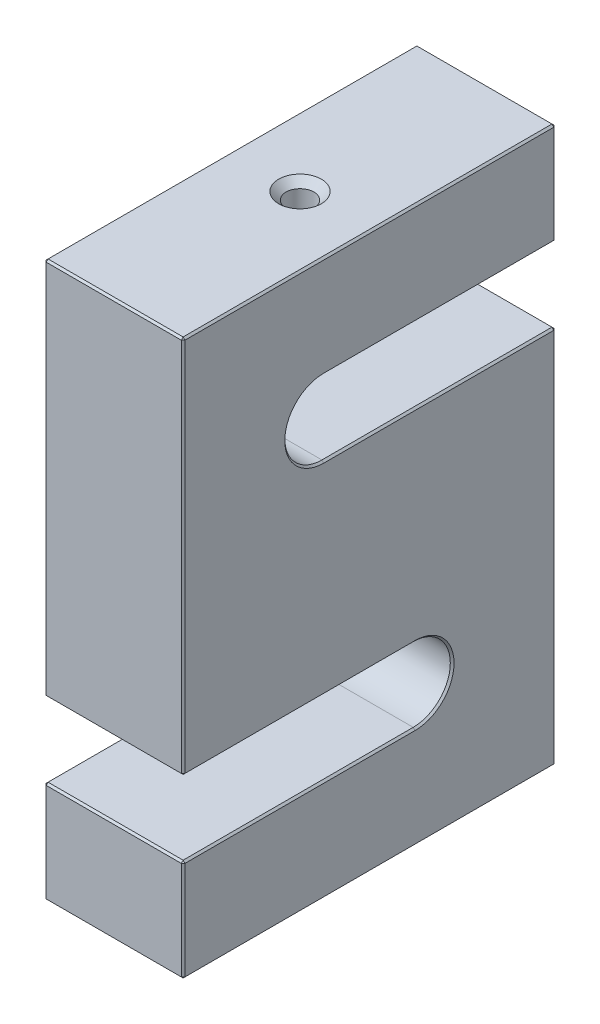
from build123d import *

# Parameters (mm, degrees)
BOSS_EXTRUDE1_DEPTH = 19
SKETCH2_R           = 1.905
CUT_EXTRUDE1_DEPTH  = 10.16
CHAMFER1_SIZE       = 1.016
CHAMFER2_SIZE       = 0.254
CHAMFER3_SIZE       = 1.016


with BuildPart() as part:
    # Sketch1 → Boss-Extrude1 (new body)
    with BuildSketch(Plane(origin=(0, 0, 0), x_dir=(0, 0, -1), z_dir=(1, 0, 0))):
        with BuildLine():
            Line((6.25, -13.87), (-25.5, -13.87))
            Line((-25.5, -13.87), (-25.5, 38))
            Line((-25.5, 38), (25.5, 38))
            Line((25.5, 38), (25.5, 24.08))
            Line((25.5, 24.08), (-6.25, 24.08))
            ThreePointArc((-6.25, 24.08), (-11.33, 19), (-6.25, 13.92))
            Line((-6.25, 13.92), (25.5, 13.92))
            Line((25.5, 13.92), (25.5, -38))
            Line((25.5, -38), (-25.5, -38))
            Line((-25.5, -38), (-25.5, -24.03))
            Line((-25.5, -24.03), (6.25, -24.03))
            ThreePointArc((6.25, -24.03), (11.33, -18.95), (6.25, -13.87))
        make_face()
    extrude(amount=BOSS_EXTRUDE1_DEPTH)

    # Sketch2 → Cut-Extrude1 (cut)
    with BuildSketch(Plane.XZ.offset(38)):
        with Locations(Location((9.5, 0, 0), (0, 0, 270))):
            Circle(SKETCH2_R)
    cut_extrude1 = extrude(amount=-CUT_EXTRUDE1_DEPTH, mode=Mode.SUBTRACT)

    # Chamfer1
    chamfer1_edges = [part.edges().sort_by_distance(p)[0] for p in [
        (9.5, -38, 1.905),
    ]]
    chamfer(chamfer1_edges, length=CHAMFER1_SIZE)

    # Chamfer2
    chamfer2_edges = [part.edges().sort_by_distance(p)[0] for p in [
        (19, -18.95, -11.33),
        (0, 12.065, 25.5),
        (0, 38, 0),
        (0, 31.04, -25.5),
        (0, 24.08, -9.625),
        (19, -24.03, 9.625),
        (0, 19, 11.33),
        (0, 13.92, -9.625),
        (0, -12.04, -25.5),
        (0, -38, 0),
        (0, -31.015, 25.5),
        (0, -24.03, 9.625),
        (0, -18.95, -11.33),
        (0, -13.87, 9.625),
        (19, -31.015, 25.5),
        (9.5, -13.87, 25.5),
        (9.5, 38, 25.5),
        (9.5, 38, -25.5),
        (9.5, 24.08, -25.5),
        (9.5, 13.92, -25.5),
        (9.5, -38, -25.5),
        (9.5, -38, 25.5),
        (9.5, -24.03, 25.5),
        (19, -38, 0),
        (19, -12.04, -25.5),
        (19, 13.92, -9.625),
        (19, 19, 11.33),
        (19, 24.08, -9.625),
        (19, 31.04, -25.5),
        (19, 38, 0),
        (19, -13.87, 9.625),
        (19, 12.065, 25.5),
    ]]
    chamfer(chamfer2_edges, length=CHAMFER2_SIZE)

    # Mirror3: Cut-Extrude1 across plane
    add(cut_extrude1.mirror(Plane.ZX), mode=Mode.SUBTRACT)

    # Chamfer3
    chamfer3_edges = [part.edges().sort_by_distance(p)[0] for p in [
        (9.5, 38, 1.905),
    ]]
    chamfer(chamfer3_edges, length=CHAMFER3_SIZE)


solid = part.part
